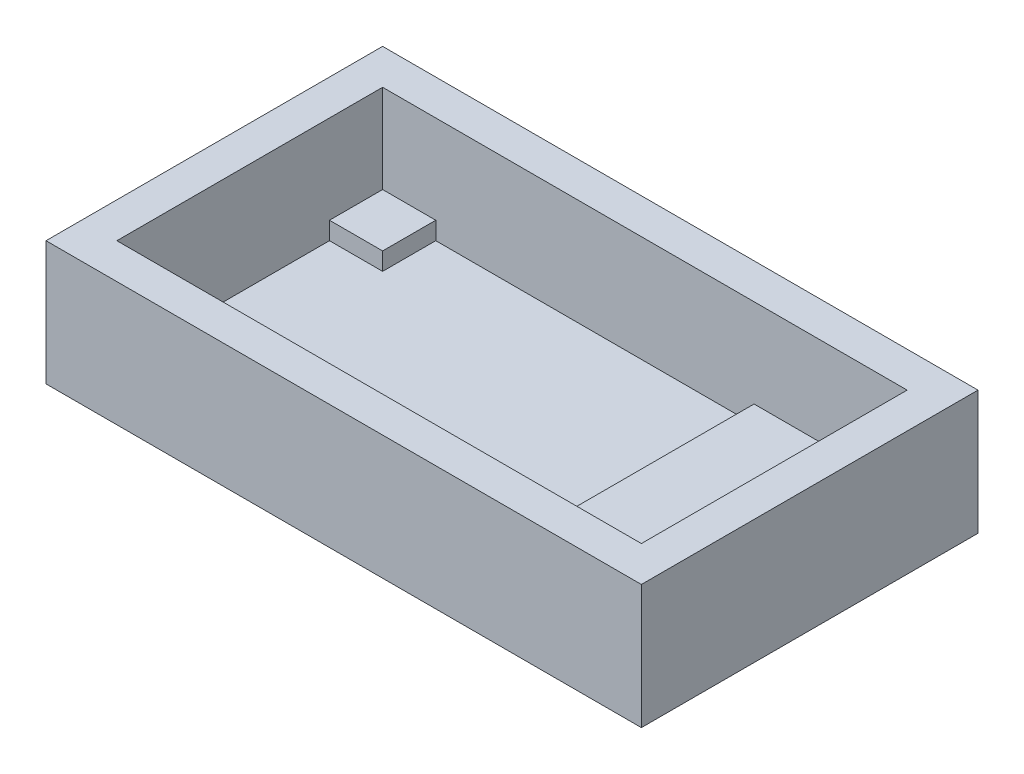
from build123d import *

# Parameters (mm, degrees)
SKETCH1_W           = 168.045783506
SKETCH1_H           = 95.010377358
BOSS_EXTRUDE1_DEPTH = 5
SKETCH2_W           = 168.045783506
SKETCH2_H           = 95.010377358
SKETCH2_W_2         = 148.045783506
SKETCH2_H_2         = 75.010377358
BOSS_EXTRUDE2_DEPTH = 30
SKETCH3_W           = 15
SKETCH3_H           = 15
SKETCH3_W_2         = 43.208090913
SKETCH3_H_2         = 75.010377358
BOSS_EXTRUDE3_DEPTH = 5


with BuildPart() as part:
    # Sketch1 → Boss-Extrude1 (new body)
    with BuildSketch(Plane(origin=(0, 0, 0), x_dir=(1, 0, 0), z_dir=(0, 1, 0))):
        with Locations((84.022891753, 47.505188679)):
            Rectangle(SKETCH1_W, SKETCH1_H)
    extrude(amount=BOSS_EXTRUDE1_DEPTH)

    # Sketch2 → Boss-Extrude2 (add)
    with BuildSketch(Plane(origin=(0, 5, 0), x_dir=(1, 0, 0), z_dir=(0, 1, 0))):
        with Locations((84.022891753, 47.505188679)):
            Rectangle(SKETCH2_W, SKETCH2_H)
        with Locations((84.022891753, 47.505188679)):
            Rectangle(SKETCH2_W_2, SKETCH2_H_2, mode=Mode.SUBTRACT)
    extrude(amount=BOSS_EXTRUDE2_DEPTH)

    # Sketch3 → Boss-Extrude3 (add)
    with BuildSketch(Plane(origin=(0, 5, 0), x_dir=(1, 0, 0), z_dir=(0, 1, 0))):
        with Locations((17.5, 77.510377358)):
            Rectangle(SKETCH3_W, SKETCH3_H)
        with Locations((17.5, 17.5)):
            Rectangle(SKETCH3_W, SKETCH3_H)
        with Locations((136.44173805, 47.505188679)):
            Rectangle(SKETCH3_W_2, SKETCH3_H_2)
    extrude(amount=BOSS_EXTRUDE3_DEPTH)


solid = part.part
